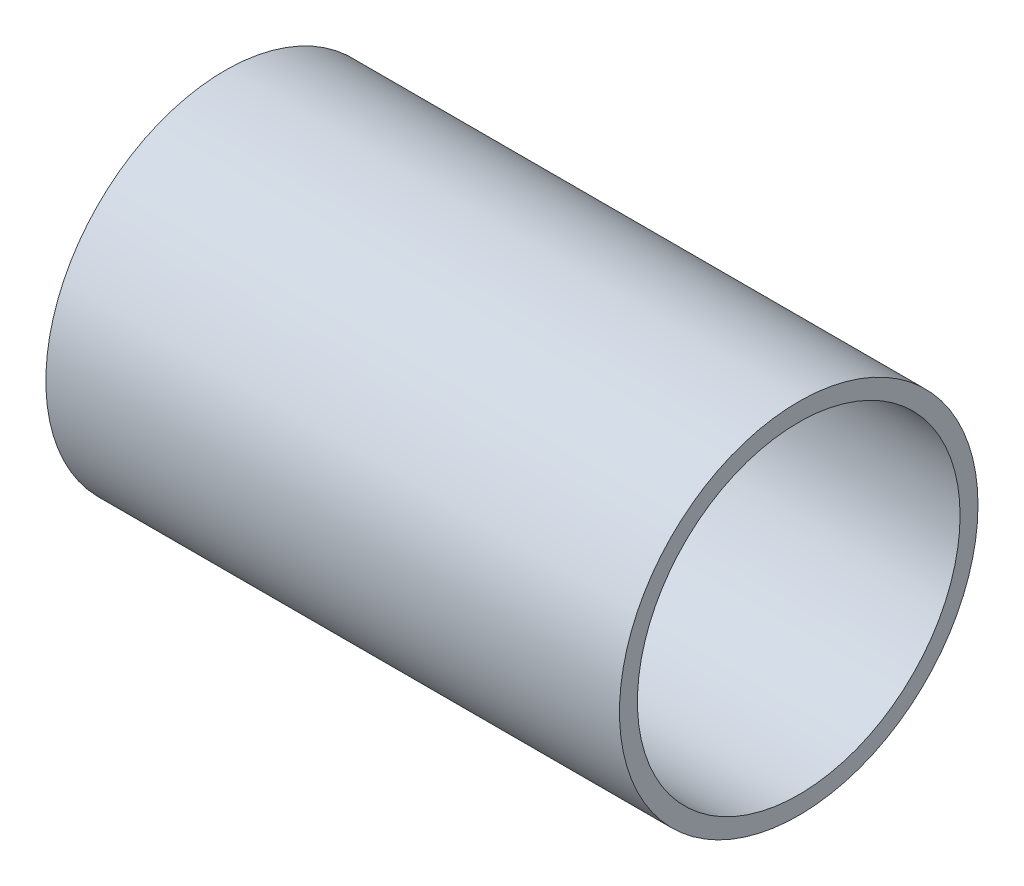
from build123d import *

# Parameters (mm, degrees)
SKETCH1_R           = 15.875
SKETCH1_R_2         = 14.2875
BOSS_EXTRUDE1_DEPTH = 25.4


with BuildPart() as part:
    # Sketch1 → Boss-Extrude1 (new, symmetric)
    with BuildSketch(Plane(origin=(0, 0, 0), x_dir=(0, 0, -1), z_dir=(1, 0, 0))):
        Circle(SKETCH1_R)
        Circle(SKETCH1_R_2, mode=Mode.SUBTRACT)
    extrude(amount=BOSS_EXTRUDE1_DEPTH, both=True)


solid = part.part
